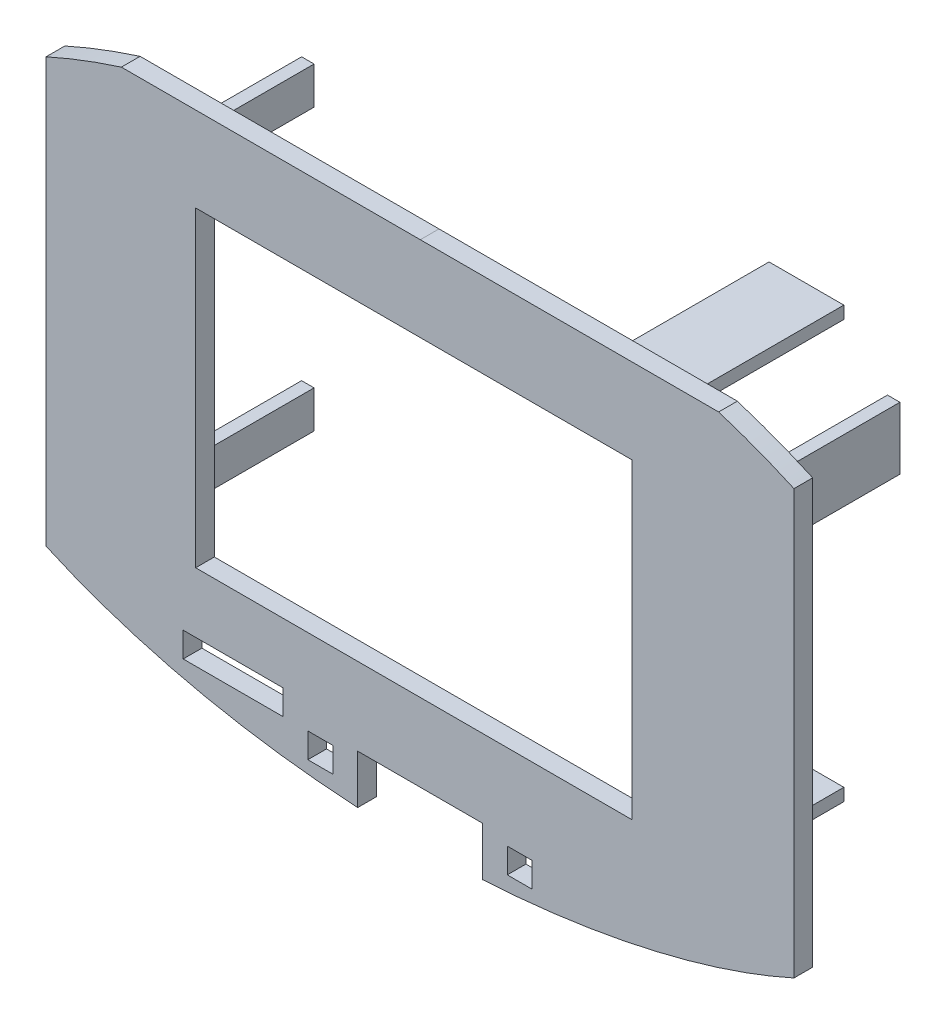
from build123d import *

# Parameters (mm, degrees)
EXTRUDE_1_DEPTH           = 3
SKETCH_3_W                = 12
SKETCH_3_H                = 2
SKETCH_3_W_2              = 2
SKETCH_3_H_2              = 6
SKETCH_3_H_3              = 10
EXTRUDE_2_DEPTH           = 26
CUT_EXTRUDE_5_DEPTH       = 80.722804771
CUT_EXTRUDE_5_DEPTH_BACK  = 3
SKETCH_5_W                = 4
SKETCH_5_H                = 4
SKETCH_5_W_2              = 16
CUT_EXTRUDE_6_DEPTH       = 3
SKETCH_6_W                = 70
SKETCH_6_H                = 50
CUT_EXTRUDE_7_DEPTH       = 10
CUT_EXTRUDE_10_DEPTH      = 80.722804771
CUT_EXTRUDE_10_DEPTH_BACK = 3


with BuildPart() as part:
    # 草图1 → 凸台-拉伸1 (new body)
    with BuildSketch(Plane.XY):
        with BuildLine():
            Line((-60, 34), (-60, -34))
            add(Edge.make_bspline(
                [(-60, -34), (0, -61.168399395), (60, -34)],
                knots=[0.841357477, 0.841357477, 0.841357477, 2.300235176, 2.300235176, 2.300235176], degree=2, weights=[1, 0.745548499, 1]))
            Line((60, -34), (60, 34))
            add(Edge.make_bspline(
                [(60, 34), (0, 61.168399395), (-60, 34)],
                knots=[3.982950131, 3.982950131, 3.982950131, 5.44182783, 5.44182783, 5.44182783], degree=2, weights=[1, 0.745548499, 1]))
        make_face()
    extrude(amount=EXTRUDE_1_DEPTH)

    # 草图3 → 凸台-拉伸2 (add)
    with BuildSketch(Plane(origin=(0, 0, 0), x_dir=(-1, 0, 0), z_dir=(0, 0, -1))):
        with Locations((-33, -33.5)):
            Rectangle(SKETCH_3_W, SKETCH_3_H)
        with Locations((47, -22.5)):
            Rectangle(SKETCH_3_W_2, SKETCH_3_H_2)
        with Locations((47, 22.5)):
            Rectangle(SKETCH_3_W_2, SKETCH_3_H_2)
        with Locations((-33, 33.5)):
            Rectangle(SKETCH_3_W, SKETCH_3_H)
        with Locations((-47, 20.5)):
            Rectangle(SKETCH_3_W_2, SKETCH_3_H_3)
    extrude(amount=EXTRUDE_2_DEPTH)

    # 草图4 → 切除-拉伸5 (cut, two sides: drawn at the far end of the back side and taken through both)
    with BuildSketch(Plane(origin=(0, 0, 0), x_dir=(-1, 0, 0), z_dir=(0, 0, -1)).offset(-CUT_EXTRUDE_5_DEPTH_BACK)):
        Polygon((-10, -284.821306472), (-10, -45.321810815), (-10, -37.47951977), (10, -37.47951977), (10, -45.321810815), (10, -284.821306472), (10, -763.820297787), (-10, -763.820297787), align=None)
    extrude(amount=CUT_EXTRUDE_5_DEPTH + CUT_EXTRUDE_5_DEPTH_BACK, mode=Mode.SUBTRACT)

    # 草图5 → 切除-拉伸6 (cut)
    with BuildSketch(Plane(origin=(0, 0, 0), x_dir=(-1, 0, 0), z_dir=(0, 0, -1))):
        with Locations((-16, -40.670164979)):
            Rectangle(SKETCH_5_W, SKETCH_5_H)
        with Locations((30, -36.670164979)):
            Rectangle(SKETCH_5_W_2, SKETCH_5_H)
        with Locations((16, -40.670164979)):
            Rectangle(SKETCH_5_W, SKETCH_5_H)
    extrude(amount=-CUT_EXTRUDE_6_DEPTH, mode=Mode.SUBTRACT)

    # 草图6 → 切除-拉伸7 (cut)
    with BuildSketch(Plane(origin=(0, 0, 0), x_dir=(-1, 0, 0), z_dir=(0, 0, -1))):
        with Locations((1, 1.9417e-05)):
            Rectangle(SKETCH_6_W, SKETCH_6_H)
    extrude(amount=-CUT_EXTRUDE_7_DEPTH, mode=Mode.SUBTRACT)

    # 草图7 → 切除-拉伸10 (cut, two sides: drawn at the far end of the back side and taken through both)
    with BuildSketch(Plane(origin=(0, 0, 0), x_dir=(-1, 0, 0), z_dir=(0, 0, -1)).offset(-CUT_EXTRUDE_10_DEPTH_BACK)):
        with BuildLine():
            Line((-47.914442952, 38.608895735), (-0.047490379, 38.608895735))
            Line((-0.047490379, 38.608895735), (47.914442952, 38.608895735))
            add(Edge.make_bspline(
                [(-47.914442952, 38.608895735), (0, 53.86648698), (47.914442952, 38.608895735)],
                knots=[4.161758339, 4.161758339, 4.161758339, 5.263019622, 5.263019622, 5.263019622], degree=2, weights=[0.945270908, 0.800277591, 0.945270908]))
        make_face()
    extrude(amount=CUT_EXTRUDE_10_DEPTH + CUT_EXTRUDE_10_DEPTH_BACK, mode=Mode.SUBTRACT)


solid = part.part
